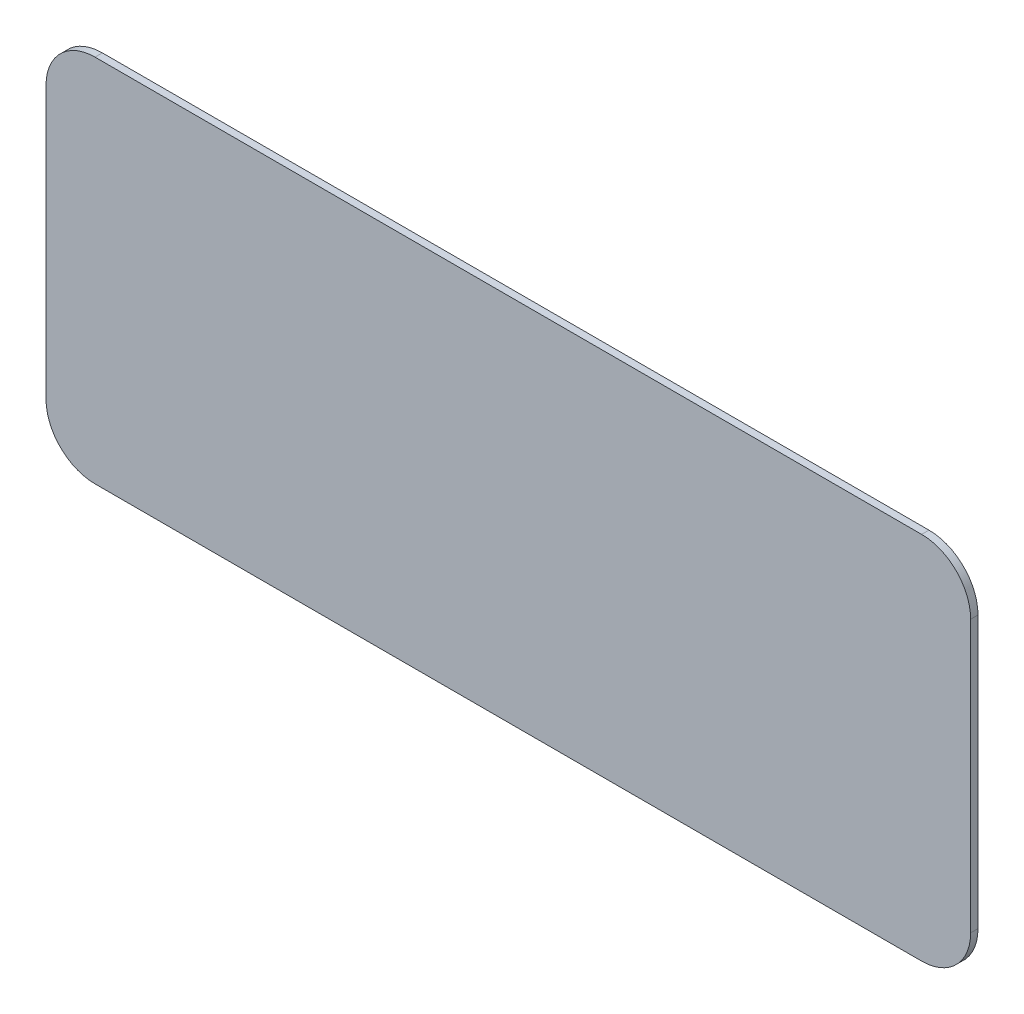
from build123d import *

# Parameters (mm, degrees)
SALIENTE_EXTRUIR1_DEPTH = 3


with BuildPart() as part:
    # Croquis1 → Saliente-Extruir1 (new body)
    with BuildSketch(Plane.XY):
        with BuildLine():
            Line((94.93, 0), (94.93, 110.871))
            ThreePointArc((94.93, 110.871), (89.072135624, 125.013135624), (74.93, 130.871))
            Line((74.93, 130.871), (-262.531032337, 130.871))
            ThreePointArc((-262.531032337, 130.871), (-276.673167961, 125.013135624), (-282.531032337, 110.871))
            Line((-282.531032337, 110.871), (-282.531032337, 0))
            ThreePointArc((-282.531032337, 0), (-276.673167961, -14.142135624), (-262.531032337, -20))
            Line((-262.531032337, -20), (74.93, -20))
            ThreePointArc((74.93, -20), (89.072135624, -14.142135624), (94.93, 0))
        make_face()
    extrude(amount=SALIENTE_EXTRUIR1_DEPTH)


solid = part.part
